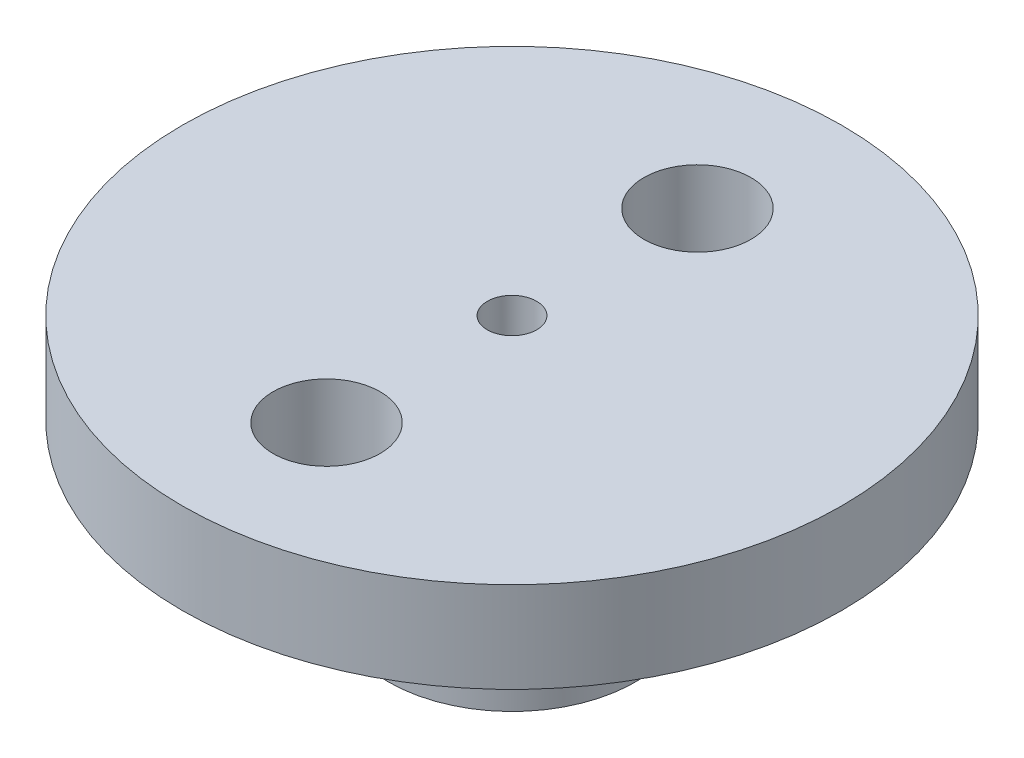
from build123d import *

# Parameters (mm, degrees)
SKETCH1_R           = 8
BOSS_EXTRUDE1_DEPTH = 2.2
SKETCH2_R           = 1.3
CUT_EXTRUDE1_DEPTH  = 2.2
SKETCH3_R           = 3
SKETCH3_R_2         = 2.45
BOSS_EXTRUDE2_DEPTH = 4
SKETCH8_R           = 0.6
CUT_EXTRUDE7_DEPTH  = 2.2


with BuildPart() as part:
    # Sketch1 → Boss-Extrude1 (new body)
    with BuildSketch(Plane(origin=(0, 0, 0), x_dir=(1, 0, 0), z_dir=(0, 1, 0))):
        with Locations(Location((0, 0, 0), (0, 0, 270))):
            Circle(SKETCH1_R)
    extrude(amount=BOSS_EXTRUDE1_DEPTH)

    # Sketch2 → Cut-Extrude1 (cut)
    with BuildSketch(Plane(origin=(0, 2.2, 0), x_dir=(1, 0, 0), z_dir=(0, 1, 0))):
        with Locations(Location((0, 4.5, 0), (0, 0, 270))):
            Circle(SKETCH2_R)
        with Locations(Location((0, -4.5, 0), (0, 0, 90))):
            Circle(SKETCH2_R)
    extrude(amount=-CUT_EXTRUDE1_DEPTH, mode=Mode.SUBTRACT)

    # Sketch3 → Boss-Extrude2 (add)
    with BuildSketch(Plane.XZ):
        with Locations(Location((0, 0, 0), (0, 0, 90))):
            Circle(SKETCH3_R)
        with Locations(Location((0, 0, 0), (0, 0, 270))):
            Circle(SKETCH3_R_2, mode=Mode.SUBTRACT)
    extrude(amount=BOSS_EXTRUDE2_DEPTH)

    # Sketch8 → Cut-Extrude7 (cut)
    with BuildSketch(Plane.XZ):
        with Locations(Location((0, 0, 0), (0, 0, 270))):
            Circle(SKETCH8_R)
    extrude(amount=-CUT_EXTRUDE7_DEPTH, mode=Mode.SUBTRACT)


solid = part.part
